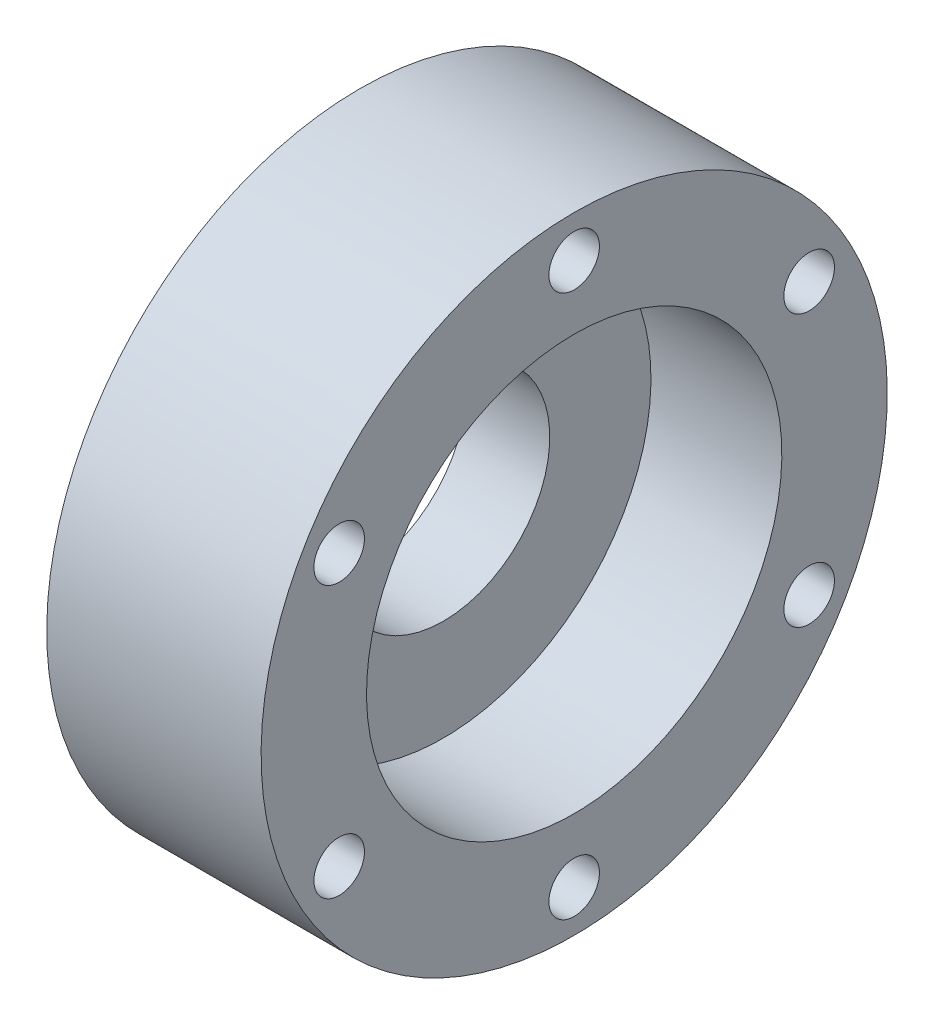
from build123d import *

# Parameters (mm, degrees)
SKETCH2_R          = 6.477
CUT_EXTRUDE1_DEPTH = 30.931960183
SKETCH3_R          = 1.538145308
CUT_EXTRUDE2_DEPTH = 30.931960183


with BuildPart() as part:
    # Sketch1 → Revolve1 (revolve)
    with BuildSketch(Plane.XY):
        Polygon((0, 0), (0, 19.05), (13.0429, 19.05), (13.0429, 12.6365), (5.08, 12.6365), (5.08, 0), align=None)
    revolve(axis=Axis((5.08, 0, 0), (-1, 0, 0)))

    # Sketch2 → Cut-Extrude1 (cut, through all)
    with BuildSketch(Plane.ZY):
        with Locations(Location((0, 0, 0), (0, 0, 270))):
            Circle(SKETCH2_R)
    extrude(amount=-CUT_EXTRUDE1_DEPTH, mode=Mode.SUBTRACT)

    # Sketch3 → Cut-Extrude2 (cut, through all)
    with BuildSketch(Plane.ZY):
        with Locations(Location((0, 16.51, 0), (0, 0, 270))):
            Circle(SKETCH3_R)
        with Locations(Location((14.298079416, 8.255, 0), (0, 0, 270))):
            Circle(SKETCH3_R)
        with Locations(Location((14.298079416, -8.255, 0), (0, 0, 270))):
            Circle(SKETCH3_R)
        with Locations(Location((0, -16.51, 0), (0, 0, 270))):
            Circle(SKETCH3_R)
        with Locations(Location((-14.298079416, -8.255, 0), (0, 0, 270))):
            Circle(SKETCH3_R)
        with Locations(Location((-14.298079416, 8.255, 0), (0, 0, 270))):
            Circle(SKETCH3_R)
    extrude(amount=-CUT_EXTRUDE2_DEPTH, mode=Mode.SUBTRACT)


solid = part.part
